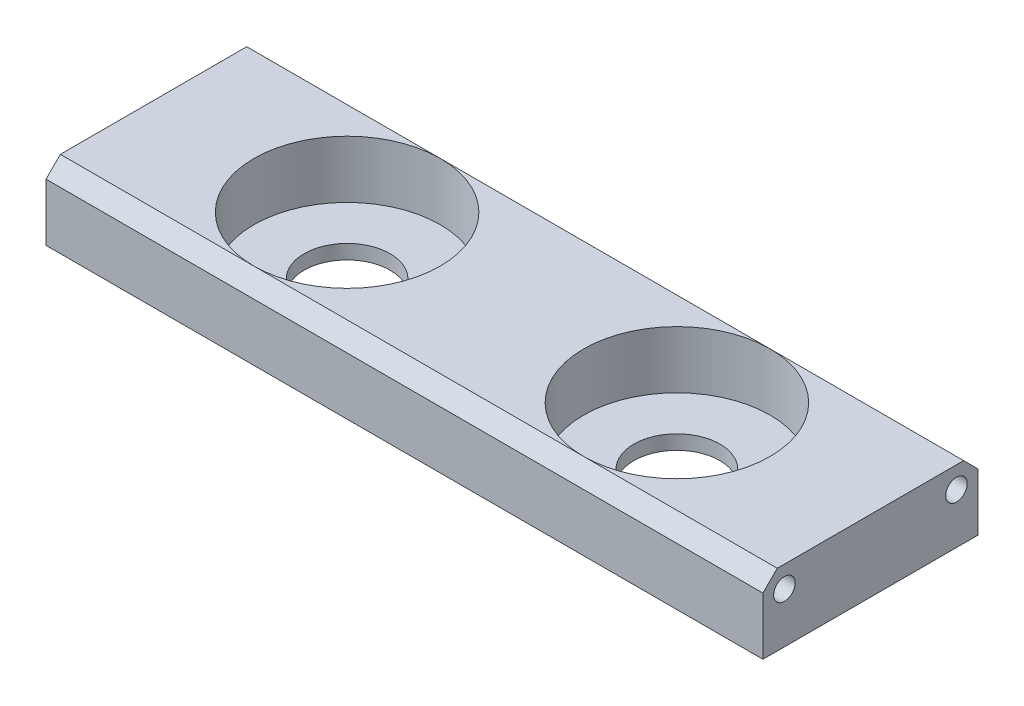
from build123d import *

# Parameters (mm, degrees)
SKETCH1_W           = 100
SKETCH1_H           = 30
BOSS_EXTRUDE1_DEPTH = 6
SKETCH2_R           = 6
CUT_EXTRUDE1_DEPTH  = 105.575331699
CHAMFER1_SIZE       = 2
SKETCH3_R           = 1.5
CUT_EXTRUDE2_DEPTH  = 7
CUT_EXTRUDE3_START  = -7
SKETCH4_R           = 1.5
CUT_EXTRUDE3_DEPTH  = 7
SKETCH5_W           = 100
SKETCH5_H           = 30
SKETCH5_R           = 6
BOSS_EXTRUDE2_DEPTH = 4
SKETCH6_R           = 13
CUT_EXTRUDE4_DEPTH  = 8


with BuildPart() as part:
    # Sketch1 → Boss-Extrude1 (new body)
    with BuildSketch(Plane(origin=(0, 0, 0), x_dir=(1, 0, 0), z_dir=(0, 1, 0))):
        with Locations((50, 15)):
            Rectangle(SKETCH1_W, SKETCH1_H)
    extrude(amount=BOSS_EXTRUDE1_DEPTH)

    # Sketch2 → Cut-Extrude1 (cut, through all)
    with BuildSketch(Plane(origin=(0, 6, 0), x_dir=(1, 0, 0), z_dir=(0, 1, 0))):
        with Locations(Location((27, 15, 0), (0, 0, 270))):
            Circle(SKETCH2_R)
        with Locations(Location((73, 15, 0), (0, 0, 270))):
            Circle(SKETCH2_R)
    extrude(amount=-CUT_EXTRUDE1_DEPTH, mode=Mode.SUBTRACT)

    # Chamfer1
    chamfer1_edges = [part.edges().sort_by_distance(p)[0] for p in [
        (50, 6, -30),
        (50, 6, 0),
    ]]
    chamfer(chamfer1_edges, length=CHAMFER1_SIZE)

    # Sketch3 → Cut-Extrude2 (cut)
    with BuildSketch(Plane(origin=(100, 0, 0), x_dir=(0, 0, -1), z_dir=(1, 0, 0))):
        with Locations((3, 3)):
            Circle(SKETCH3_R)
        with Locations((27, 3)):
            Circle(SKETCH3_R)
    extrude(amount=-CUT_EXTRUDE2_DEPTH, mode=Mode.SUBTRACT)

    # Sketch4 → Cut-Extrude3 (cut)
    with BuildSketch(Plane.ZY.offset(CUT_EXTRUDE3_START)):
        with Locations(Location((-27, 3, 0), (0, 0, 180))):
            Circle(SKETCH4_R)
        with Locations(Location((-3, 3, 0), (0, 0, 180))):
            Circle(SKETCH4_R)
    extrude(amount=CUT_EXTRUDE3_DEPTH, mode=Mode.SUBTRACT)

    # Sketch5 → Boss-Extrude2 (add)
    with BuildSketch(Plane.XZ):
        with Locations((50, -15)):
            Rectangle(SKETCH5_W, SKETCH5_H)
        with Locations(Location((27, -15, 0), (0, 0, 90))):
            Circle(SKETCH5_R, mode=Mode.SUBTRACT)
        with Locations(Location((73, -15, 0), (0, 0, 90))):
            Circle(SKETCH5_R, mode=Mode.SUBTRACT)
    extrude(amount=BOSS_EXTRUDE2_DEPTH)

    # Sketch6 → Cut-Extrude4 (cut)
    with BuildSketch(Plane(origin=(0, 6, 0), x_dir=(1, 0, 0), z_dir=(0, 1, 0))):
        with Locations(Location((27, 15, 0), (0, 0, 270))):
            Circle(SKETCH6_R)
        with Locations(Location((73, 15, 0), (0, 0, 270))):
            Circle(SKETCH6_R)
    extrude(amount=-CUT_EXTRUDE4_DEPTH, mode=Mode.SUBTRACT)


solid = part.part
